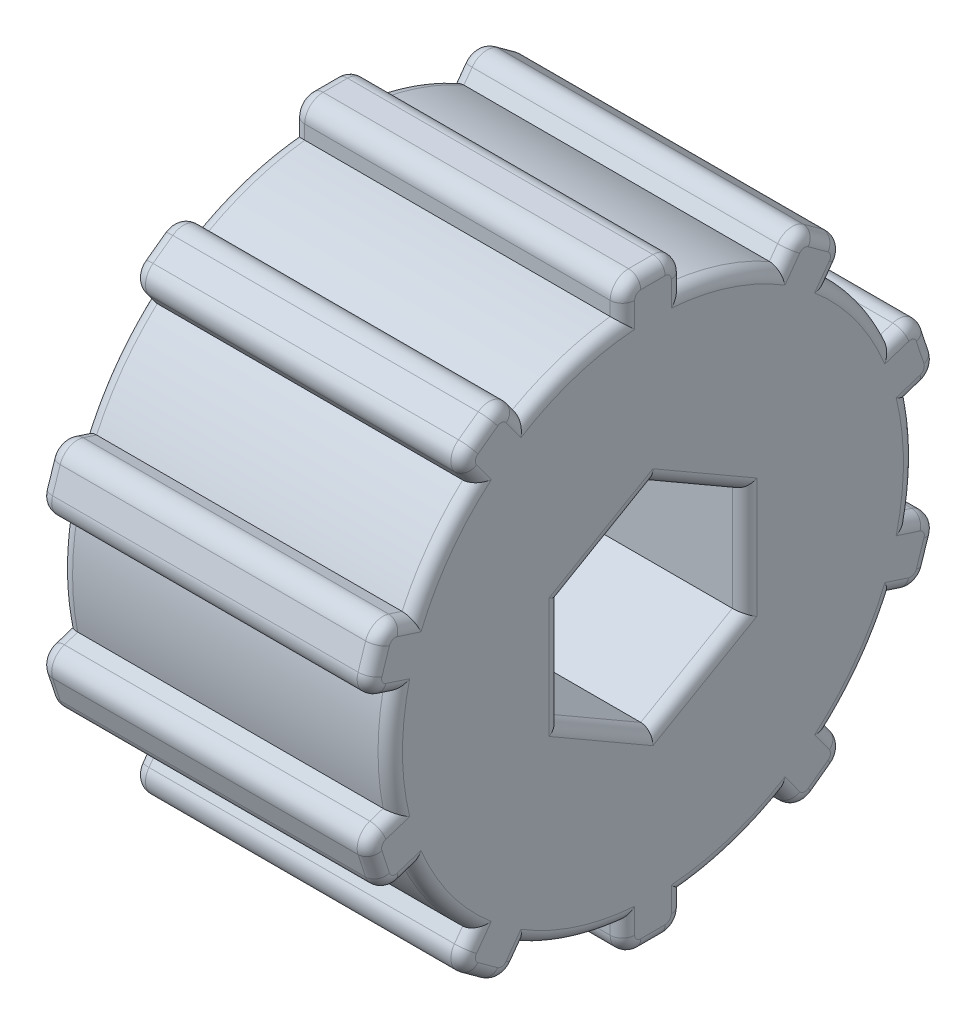
from build123d import *

# Parameters (mm, degrees)
CROQUIS1_R                 = 21.5
SALIENTE_EXTRUIR1_DEPTH    = 27
CROQUIS4_W                 = 5
CROQUIS4_H                 = 5
SALIENTE_EXTRUIR2_DEPTH    = 27
REDONDEO2_R                = 1.5
MATRIZC1_COUNT             = 10
REDONDEO2_OF_MATRIZC1_R    = 1.5
CORTAR_EXTRUIR2_DEPTH      = 27
CORTAR_EXTRUIR3_REACH      = 49.413
CORTAR_EXTRUIR3_END_RADIUS = 21.5
CROQUIS6_R                 = 1.1
CROQUIS7_R                 = 2.25
CORTAR_EXTRUIR4_DEPTH      = 12
REDONDEO3_R                = 0.3
REDONDEO4_R                = 1


with BuildPart() as part:
    # Croquis1 → Saliente-Extruir1 (new body)
    with BuildSketch(Plane(origin=(0, 0, 0), x_dir=(0, 0, -1), z_dir=(1, 0, 0))):
        Circle(CROQUIS1_R)
    extrude(amount=SALIENTE_EXTRUIR1_DEPTH)

    # Croquis4 → Saliente-Extruir2 (add)
    with BuildSketch(Plane.ZY):
        with Locations((0, 21.5)):
            Rectangle(CROQUIS4_W, CROQUIS4_H)
    saliente_extruir2 = extrude(amount=-SALIENTE_EXTRUIR2_DEPTH)

    # Redondeo2
    redondeo2_edges = [part.edges().sort_by_distance(p)[0] for p in [
        (13.5, 24, 2.5),
        (13.5, 24, -2.5),
    ]]
    fillet(redondeo2_edges, radius=REDONDEO2_R)

    # MatrizC1: Saliente-Extruir2 ×10 about axis
    matrizc1_axis = Axis((0, 0, 0), (1, 0, 0))
    for i in range(1, MATRIZC1_COUNT):
        add(saliente_extruir2.rotate(matrizc1_axis, i * 360 / MATRIZC1_COUNT))

    # Redondeo2 of MatrizC1
    redondeo2_of_matrizc1_edges = [part.edges().sort_by_distance(p)[0] for p in [
        (13.5, 17.946944734, 16.129388541),
        (13.5, 20.885870996, 12.084303569),
        (13.5, 5.038766574, 23.597898877),
        (13.5, 9.794049156, 22.052813905),
        (13.5, -9.794049156, 22.052813905),
        (13.5, -5.038766574, 23.597898877),
        (13.5, -20.885870996, 12.084303569),
        (13.5, -17.946944734, 16.129388541),
        (13.5, -24, -2.5),
        (13.5, -24, 2.5),
        (13.5, -17.946944734, -16.129388541),
        (13.5, -20.885870996, -12.084303569),
        (13.5, -5.038766574, -23.597898877),
        (13.5, -9.794049156, -22.052813905),
        (13.5, 9.794049156, -22.052813905),
        (13.5, 5.038766574, -23.597898877),
        (13.5, 20.885870996, -12.084303569),
        (13.5, 17.946944734, -16.129388541),
    ]]
    fillet(redondeo2_of_matrizc1_edges, radius=REDONDEO2_OF_MATRIZC1_R)

    # Croquis5 → Cortar-Extruir2 (cut)
    with BuildSketch(Plane.ZY):
        Polygon((0, -8.660254038), (7.5, -4.330127019), (7.5, 4.330127019), (0, 8.660254038), (-7.5, 4.330127019), (-7.5, -4.330127019), align=None)
    extrude(amount=-CORTAR_EXTRUIR2_DEPTH, mode=Mode.SUBTRACT)

    # Cortar-Extruir3: up to this cylinder (the profile starts inside it)
    cortar_extruir3_end = Plane(origin=(14.575, 0, 0), z_dir=(-1, 0, 0)) * Cylinder(CORTAR_EXTRUIR3_END_RADIUS, 142.826, mode=Mode.PRIVATE)
    # Croquis6 → Cortar-Extruir3 (cut, up to the surface)
    with BuildSketch(Plane.XY.offset(-7.5), mode=Mode.PRIVATE) as cortar_extruir3_sk1:
        with Locations((14.575, 0)):
            Circle(CROQUIS6_R)
    cortar_extruir3_tool1 = extrude(cortar_extruir3_sk1.sketch, amount=-CORTAR_EXTRUIR3_REACH, mode=Mode.PRIVATE) & cortar_extruir3_end
    add(cortar_extruir3_tool1.solids().sort_by_distance((14.575, 0, -7.5))[0], mode=Mode.SUBTRACT)

    # Croquis7 → Cortar-Extruir4 (cut)
    with BuildSketch(Plane(origin=(0, 0, -21.5), x_dir=(-1, 0, 0), z_dir=(0, 0, -1))):
        with Locations(Location((-14.575, 0, 0), (0, 0, 90))):
            Circle(CROQUIS7_R)
    extrude(amount=-CORTAR_EXTRUIR4_DEPTH, mode=Mode.SUBTRACT)

    # Redondeo3
    redondeo3_edges = [part.edges().sort_by_distance(p)[0] for p in [
        (14.575, -2.25, -21.381943317),
        (14.575, -2.25, -9.5),
    ]]
    fillet(redondeo3_edges, radius=REDONDEO3_R)

    # Redondeo4
    redondeo4_edges = [part.edges().sort_by_distance(p)[0] for p in [
        (0, -12.637382924, 17.393865379),
        (27, -12.637382924, 17.393865379),
        (27, -9.153481108, 20.081348169),
        (0, -9.153481108, 20.081348169),
        (0, 20.4477151, 6.643865379),
        (0, -20.4477151, 6.643865379),
        (27, -20.4477151, 6.643865379),
        (27, -19.208842074, 10.865870736),
        (0, -19.208842074, 10.865870736),
        (27, 20.4477151, 6.643865379),
        (0, -20.4477151, -6.643865379),
        (27, -20.4477151, -6.643865379),
        (27, -21.927078252, -2.5),
        (0, -21.927078252, -2.5),
        (0, -12.637382924, -17.393865379),
        (27, -12.637382924, -17.393865379),
        (27, -16.269915812, -14.910955708),
        (0, -16.269915812, -14.910955708),
        (27, 21.927078252, 2.5),
        (0, 21.927078252, 2.5),
        (0, 0, -21.5),
        (27, 0, -21.5),
        (27, -4.398198526, -21.626433141),
        (0, -4.398198526, -21.626433141),
        (0, 12.637382924, -17.393865379),
        (27, 12.637382924, -17.393865379),
        (27, 9.153481108, -20.081348169),
        (0, 9.153481108, -20.081348169),
        (0, 20.4477151, -6.643865379),
        (27, 20.4477151, -6.643865379),
        (27, 19.208842074, -10.865870736),
        (0, 19.208842074, -10.865870736),
        (27, 19.416407865, 14.106846055),
        (0, 19.416407865, 14.106846055),
        (0, 19.208842074, 10.865870736),
        (0, 17.849748819, 15.515717682),
        (0, 20.272200137, 12.181499485),
        (27, 19.208842074, 10.865870736),
        (27, 17.849748819, 15.515717682),
        (27, 20.272200137, 12.181499485),
        (27, 7.416407865, 22.825356391),
        (0, 7.416407865, 22.825356391),
        (0, 9.153481108, 20.081348169),
        (0, 5.320840108, 23.044298397),
        (0, 9.240448676, 21.770740372),
        (27, 9.153481108, 20.081348169),
        (27, 5.320840108, 23.044298397),
        (27, 9.240448676, 21.770740372),
        (27, -7.416407865, 22.825356391),
        (0, -7.416407865, 22.825356391),
        (0, -4.398198526, 21.626433141),
        (0, -9.240448676, 21.770740372),
        (0, -5.320840108, 23.044298397),
        (27, -4.398198526, 21.626433141),
        (27, -9.240448676, 21.770740372),
        (27, 24, 0),
        (27, -5.320840108, 23.044298397),
        (0, 24, 0),
        (27, -19.416407865, 14.106846055),
        (0, -19.416407865, 14.106846055),
        (0, -16.269915812, 14.910955708),
        (0, -20.272200137, 12.181499485),
        (0, 21.927078252, -2.5),
        (0, -17.849748819, 15.515717682),
        (0, 23.560660172, 2.060660172),
        (27, -16.269915812, 14.910955708),
        (27, -20.272200137, 12.181499485),
        (27, -17.849748819, 15.515717682),
        (0, 23.560660172, -2.060660172),
        (27, -24, 0),
        (0, -24, 0),
        (0, -21.927078252, 2.5),
        (0, -23.560660172, -2.060660172),
        (0, -23.560660172, 2.060660172),
        (27, -21.927078252, 2.5),
        (27, -23.560660172, -2.060660172),
        (27, -23.560660172, 2.060660172),
        (27, 21.927078252, -2.5),
        (27, 23.560660172, 2.060660172),
        (27, -19.416407865, -14.106846055),
        (0, -19.416407865, -14.106846055),
        (0, -19.208842074, -10.865870736),
        (0, -17.849748819, -15.515717682),
        (0, -20.272200137, -12.181499485),
        (27, -19.208842074, -10.865870736),
        (27, -17.849748819, -15.515717682),
        (27, -20.272200137, -12.181499485),
        (27, 23.560660172, -2.060660172),
        (27, -7.416407865, -22.825356391),
        (0, -7.416407865, -22.825356391),
        (0, -9.153481108, -20.081348169),
        (0, -5.320840108, -23.044298397),
        (0, -9.240448676, -21.770740372),
        (27, -9.153481108, -20.081348169),
        (27, -5.320840108, -23.044298397),
        (27, -9.240448676, -21.770740372),
        (27, 7.416407865, -22.825356391),
        (0, 7.416407865, -22.825356391),
        (0, 4.398198526, -21.626433141),
        (0, 9.240448676, -21.770740372),
        (0, 5.320840108, -23.044298397),
        (27, 4.398198526, -21.626433141),
        (27, 9.240448676, -21.770740372),
        (27, 5.320840108, -23.044298397),
        (27, 19.416407865, -14.106846055),
        (0, 19.416407865, -14.106846055),
        (0, 16.269915812, -14.910955708),
        (0, 20.272200137, -12.181499485),
        (0, 17.849748819, -15.515717682),
        (27, 16.269915812, -14.910955708),
        (27, 20.272200137, -12.181499485),
        (27, 17.849748819, -15.515717682),
        (0, -6.495190528, -3.75),
        (0, -6.495190528, 3.75),
        (0, 0, 7.5),
        (0, 6.495190528, 3.75),
        (0, 6.495190528, -3.75),
        (0, 0, -7.5),
        (27, -6.495190528, 3.75),
        (27, 0, 7.5),
        (27, 6.495190528, 3.75),
        (27, 6.495190528, -3.75),
        (27, 0, -7.5),
        (27, -6.495190528, -3.75),
        (0, 12.637382924, 17.393865379),
        (27, 12.637382924, 17.393865379),
        (27, 16.269915812, 14.910955708),
        (0, 16.269915812, 14.910955708),
        (0, 0, 21.5),
        (27, 0, 21.5),
        (27, 4.398198526, 21.626433141),
        (0, 4.398198526, 21.626433141),
    ]]
    fillet(redondeo4_edges, radius=REDONDEO4_R)


solid = part.part
